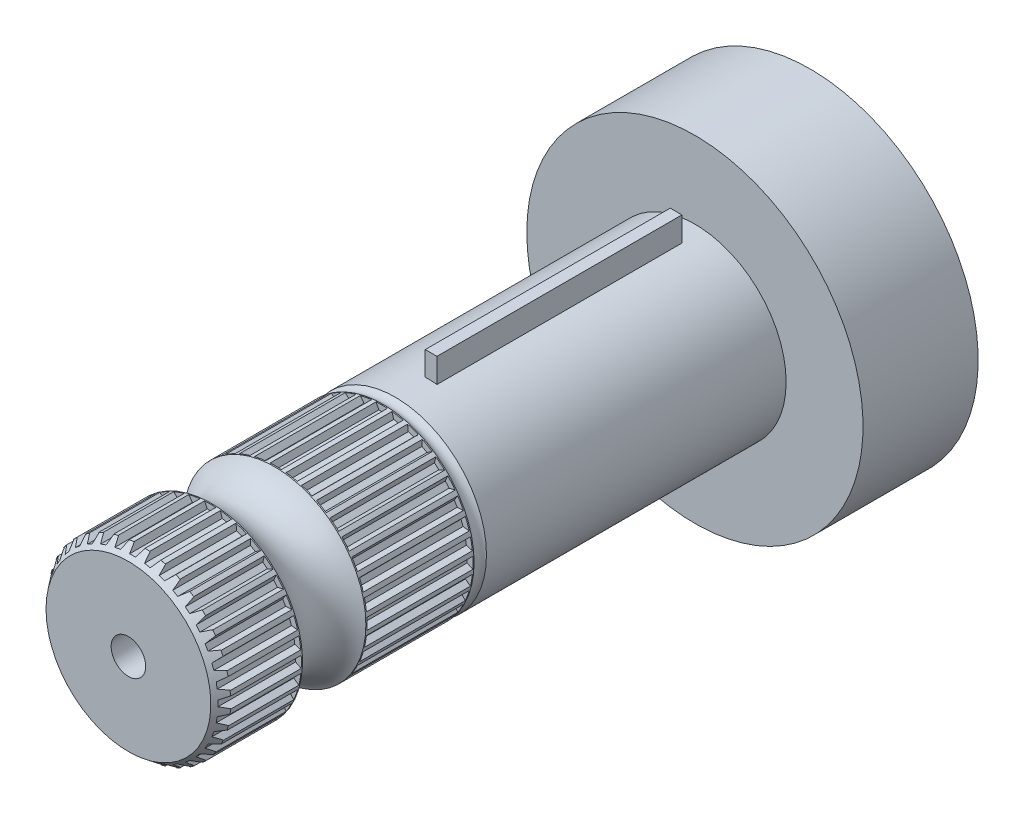
from build123d import *

# Parameters (mm, degrees)
BOSS_EXTRUDE1_DEPTH      = 49.2
BOSS_EXTRUDE1_DEPTH_BACK = 10
SKETCH1_R                = 7.9225
SKETCH9_R                = 14.6
BOSS_EXTRUDE2_DEPTH      = 10
CUT_EXTRUDE1_START       = -60
CUT_EXTRUDE1_DEPTH       = 7.9
CIRPATTERN1_COUNT        = 36
CUT_EXTRUDE2_START       = -46.4
CUT_EXTRUDE2_DEPTH       = 9.2
CIRPATTERN2_COUNT        = 36
SKETCH8_R                = 1.5
CUT_EXTRUDE3_DEPTH       = 5
SKETCH14_W               = 1.017802565
SKETCH14_H               = 21.275377075
BOSS_EXTRUDE3_DEPTH      = 10


with BuildPart() as part:
    # Sketch1 → Boss-Extrude1 (new, two sides: drawn at the far end of the back side and taken through both)
    with BuildSketch(Plane.XY.offset(-BOSS_EXTRUDE1_DEPTH_BACK)):
        Circle(SKETCH1_R)
    extrude(amount=BOSS_EXTRUDE1_DEPTH + BOSS_EXTRUDE1_DEPTH_BACK)

    # Sketch9 → Boss-Extrude2 (add)
    with BuildSketch(Plane(origin=(0, 0, -10), x_dir=(-1, 0, 0), z_dir=(0, 0, -1))):
        Circle(SKETCH9_R)
    extrude(amount=-BOSS_EXTRUDE2_DEPTH)

    # Sketch5 → Cut-Extrude1 (cut)
    with BuildSketch(Plane(origin=(0, 0, -10), x_dir=(-1, 0, 0), z_dir=(0, 0, -1)).offset(CUT_EXTRUDE1_START)):
        Polygon((0.25, 7.4225), (-0.25, 7.4225), (-0.75, 8.4225), (0.75, 8.4225), align=None)
    cut_extrude1 = extrude(amount=CUT_EXTRUDE1_DEPTH, mode=Mode.SUBTRACT)

    # CirPattern1: Cut-Extrude1 ×36 about axis
    cirpattern1_axis = Axis((0, 0, -10), (0, 0, 1))
    for i in range(1, CIRPATTERN1_COUNT):
        add(cut_extrude1.rotate(cirpattern1_axis, i * 360 / CIRPATTERN1_COUNT), mode=Mode.SUBTRACT)

    # Sketch11 → Cut-Revolve1 (revolve, cut)
    with BuildSketch(Plane(origin=(0, 0, 0), x_dir=(1, 0, 0), z_dir=(0, 1, 0))):
        with BuildLine():
            Line((7.9225, -36.5), (9.441758475, -39.25))
            Line((9.441758475, -39.25), (7.9225, -42))
            ThreePointArc((7.9225, -42), (6.3, -39.25), (7.9225, -36.5))
        make_face()
    revolve(axis=Axis((0, 0, -10), (0, 0, 1)), mode=Mode.SUBTRACT)

    # Sketch5<2> → Cut-Extrude2 (cut)
    with BuildSketch(Plane(origin=(0, 0, -10), x_dir=(-1, 0, 0), z_dir=(0, 0, -1)).offset(CUT_EXTRUDE2_START)):
        Polygon((0.25, 7.4225), (-0.25, 7.4225), (-0.75, 8.4225), (0.75, 8.4225), align=None)
    cut_extrude2 = extrude(amount=CUT_EXTRUDE2_DEPTH, mode=Mode.SUBTRACT)

    # CirPattern2: Cut-Extrude2 ×36 about axis
    cirpattern2_axis = Axis((0, 0, 0), (0, 0, -1))
    for i in range(1, CIRPATTERN2_COUNT):
        add(cut_extrude2.rotate(cirpattern2_axis, i * 360 / CIRPATTERN2_COUNT), mode=Mode.SUBTRACT)

    # Sketch8 → Cut-Extrude3 (cut)
    with BuildSketch(Plane.XY.offset(49.2)):
        Circle(SKETCH8_R)
    extrude(amount=-CUT_EXTRUDE3_DEPTH, mode=Mode.SUBTRACT)

    # Sketch12 → Cut-Revolve2 (revolve, cut)
    with BuildSketch(Plane(origin=(0, 0, 0), x_dir=(1, 0, 0), z_dir=(0, 1, 0))):
        with BuildLine():
            Line((7.9225, -26.025674965), (8.459662518, -26.562837482))
            Line((8.459662518, -26.562837482), (7.9225, -27.1))
            ThreePointArc((7.9225, -27.1), (7.7, -26.562837482), (7.9225, -26.025674965))
        make_face()
    revolve(axis=Axis((0, 0, 0), (0, 0, -1)), mode=Mode.SUBTRACT)

    # Sketch13 → Cut-Revolve3 (revolve, cut)
    with BuildSketch(Plane(origin=(0, 0, 0), x_dir=(0, 0, -1), z_dir=(1, 0, 0))):
        Polygon((-49.2, 7.15718687), (-50.187303239, 8.621836823), (-48.2, 7.90718687), align=None)
    revolve(axis=Axis((0, 0, -10), (0, 0, 1)), mode=Mode.SUBTRACT)

    # Sketch14 → Boss-Extrude3 (add)
    with BuildSketch(Plane(origin=(0, 0, 0), x_dir=(1, 0, 0), z_dir=(0, 1, 0))):
        with Locations((0.31378966, -12.587545816)):
            Rectangle(SKETCH14_W, SKETCH14_H)
    extrude(amount=BOSS_EXTRUDE3_DEPTH)


solid = part.part
